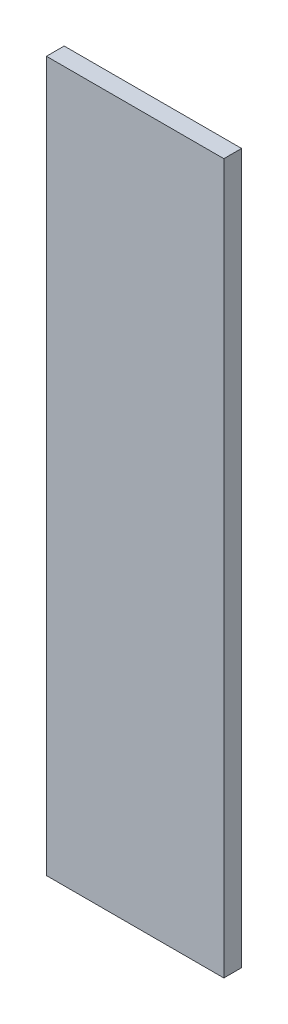
from build123d import *

# Parameters (mm, degrees)
SKETCH_1_W        = 80
SKETCH_1_H        = 320
EXTRUDE_300_DEPTH = 8


with BuildPart() as part:
    # 草图1 → Extrude 300 (new body)
    with BuildSketch(Plane.XY):
        with Locations((40, 160)):
            Rectangle(SKETCH_1_W, SKETCH_1_H)
    extrude(amount=EXTRUDE_300_DEPTH)


solid = part.part
